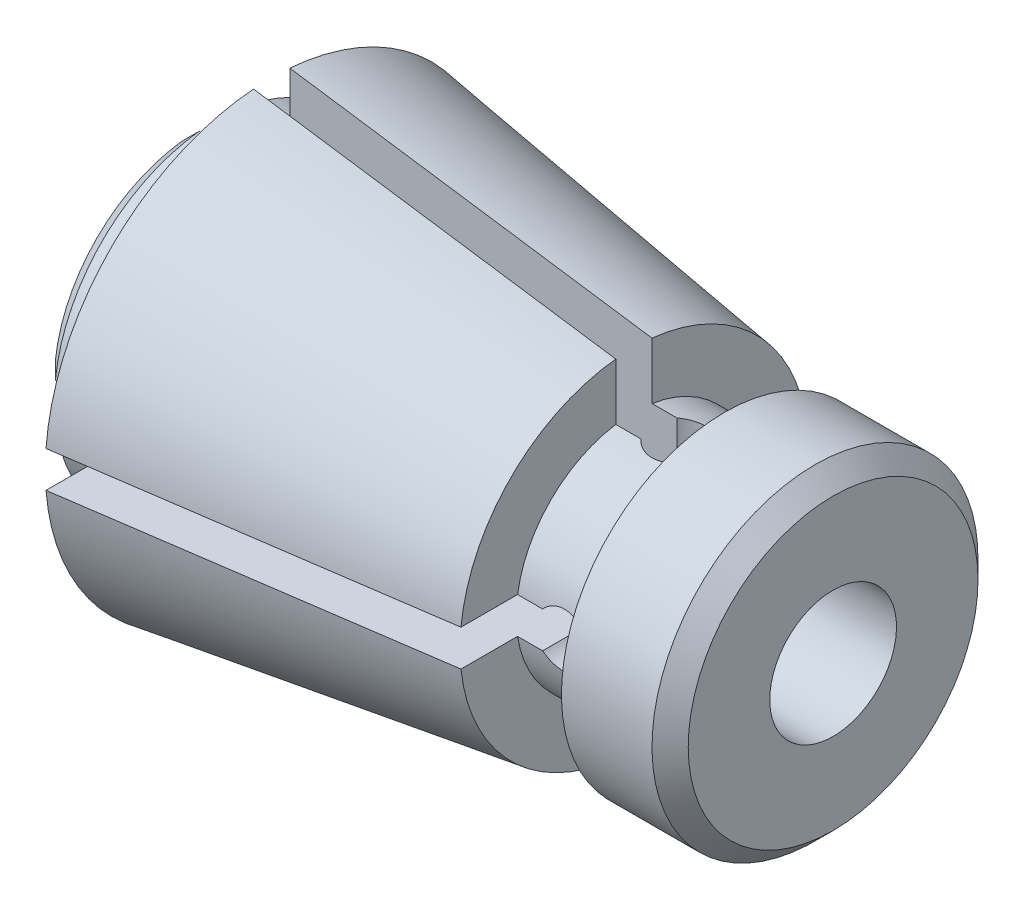
from build123d import *

# Parameters (mm, degrees)
CHAMFER_1_SIZE           = 1
SKETCH_2_R               = 1.5
CUT_EXTRUDE_1_DEPTH      = 40.210967853
SKETCH_3_W               = 30.067866829
SKETCH_3_H               = 2
CUT_EXTRUDE_1_2_DEPTH    = 40.210967853
PATTERN_CIRCULAR_1_COUNT = 4
CUT_EXTRUDE_2_DEPTH      = 40.185456486
CUT_EXTRUDE_2_DEPTH_BACK = 40.185456486
SKETCH_4_R               = 3.5


with BuildPart() as part:
    # 草图1 → 旋转1 (revolve)
    with BuildSketch(Plane.XY):
        Polygon((0, 0), (0, 9), (4, 9), (4, 12.5), (24, 9.60013801), (24, 6.5), (29, 6.5), (29, 9), (35, 9), (35, 0), align=None)
    revolve(axis=Axis((35, 0, 0), (-1, 0, 0)))

    # 倒角1
    chamfer_1_edges = [part.edges().sort_by_distance(p)[0] for p in [
        (0, -9, 0),
        (35, -9, 0),
    ]]
    chamfer(chamfer_1_edges, length=CHAMFER_1_SIZE)

    # 草图2 → Cut-Extrude 1 (cut, symmetric)
    with BuildSketch(Plane.XY):
        with Locations((26.5, 0)):
            Circle(SKETCH_2_R)
    cut_extrude_1 = extrude(amount=CUT_EXTRUDE_1_DEPTH, both=True, mode=Mode.SUBTRACT)

    # 草图3 → Cut-Extrude 1 2 (cut, symmetric)
    with BuildSketch(Plane.XY):
        with Locations((11.466066586, 0)):
            Rectangle(SKETCH_3_W, SKETCH_3_H)
    cut_extrude_1_2 = extrude(amount=CUT_EXTRUDE_1_2_DEPTH, both=True, mode=Mode.SUBTRACT)

    # 阵列(圆周)1: Cut-Extrude 1, Cut-Extrude 1 2 ×4 about axis
    pattern_circular_1_axis = Axis((35, 0, 0), (1, 0, 0))
    add([cut_extrude_1.rotate(pattern_circular_1_axis, i * 360 / PATTERN_CIRCULAR_1_COUNT) for i in range(1, PATTERN_CIRCULAR_1_COUNT)], mode=Mode.SUBTRACT)
    add([cut_extrude_1_2.rotate(pattern_circular_1_axis, i * 360 / PATTERN_CIRCULAR_1_COUNT) for i in range(1, PATTERN_CIRCULAR_1_COUNT)], mode=Mode.SUBTRACT)

    # 草图4 → 切除-拉伸2 (cut, two sides: drawn at the far end of the back side and taken through both)
    with BuildSketch(Plane(origin=(35, 0, 0), x_dir=(0, 0, -1), z_dir=(1, 0, 0)).offset(-CUT_EXTRUDE_2_DEPTH_BACK)):
        with Locations(Location((0, 0, 0), (0, 0, 90))):
            Circle(SKETCH_4_R)
    extrude(amount=CUT_EXTRUDE_2_DEPTH + CUT_EXTRUDE_2_DEPTH_BACK, mode=Mode.SUBTRACT)


solid = part.part
